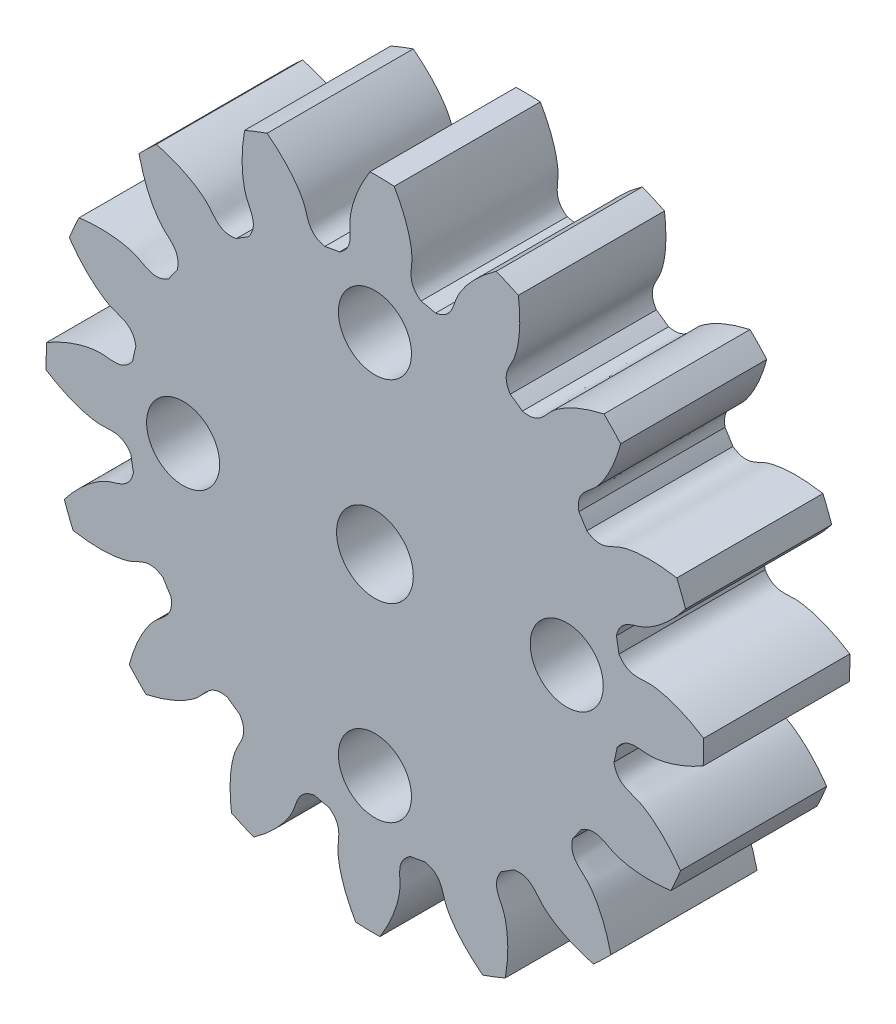
from build123d import *

# Parameters (mm, degrees)
SKETCH_1_R      = 1
SKETCH_1_R_2    = 1.05
EXTRUDE_1_DEPTH = 4


with BuildPart() as part:
    # 草图1 → 凸台-拉伸1 (new body)
    with BuildSketch(Plane.XY):
        with BuildLine():
            ThreePointArc((20.769828885, 7.697327282), (20.52624908, 7.472597504), (20.291108393, 7.239052109))
            add(Edge.make_bspline(
                [(20.291108393, 7.239052109), (20.310990881, 7.149406449), (20.347528876, 7.003899113), (20.407035462, 6.808638334), (20.460548412, 6.655296266), (20.515727337, 6.51540458), (20.571589231, 6.38883337), (20.627164799, 6.275395855), (20.681501491, 6.174849385), (20.733666394, 6.08689649), (20.782749083, 6.011186103), (20.827864425, 5.947314927), (20.868155465, 5.894829115), (20.898627835, 5.858235214), (21.12060735, 5.607984443), (21.441186967, 5.472040644), (21.339743183, 5.007788717)],
                knots=[0, 0, 0, 0, 0.059730766, 0.097547518, 0.132756218, 0.165356867, 0.195349463, 0.222734008, 0.247510501, 0.269678942, 0.289239331, 0.306191668, 0.320535953, 0.332272187, 0.337162284, 0.538120392, 0.538120392, 0.538120392, 0.538120392], degree=3))
            ThreePointArc((21.339743183, 5.007788717), (21.220590284, 4.842962791), (21.106457269, 4.674621903))
            add(Edge.make_bspline(
                [(21.106457269, 4.674621903), (20.704898976, 4.420512417), (20.467508905, 4.675263201), (20.156428637, 4.798264908), (20.111619692, 4.814384318), (20.048518341, 4.834293273), (19.973068846, 4.854842866), (19.885137087, 4.87507102), (19.784646979, 4.894008379), (19.671579972, 4.910679271), (19.545975623, 4.924105326), (19.407931705, 4.933308444), (19.257604227, 4.937313918), (19.095207289, 4.935153529), (18.921012783, 4.925868634), (18.771674168, 4.911908719), (18.680526786, 4.900750478), (18.651101303, 4.896879252)],
                knots=[0, 0, 0, 0, 0.200958108, 0.205848205, 0.217584439, 0.231928724, 0.248881062, 0.268441451, 0.290609892, 0.315386384, 0.342770929, 0.372763526, 0.405364174, 0.440572874, 0.478389626, 0.51881443, 0.538120392, 0.538120392, 0.538120392, 0.538120392], degree=3))
            ThreePointArc((18.651101303, 4.896879252), (18.51206327, 4.596042054), (18.384195556, 4.290289799))
            add(Edge.make_bspline(
                [(18.384195556, 4.290289799), (18.436870488, 4.215076707), (18.52631044, 4.094627942), (18.656010422, 3.93700269), (18.76413141, 3.815811611), (18.868644321, 3.707684607), (18.968690686, 3.612125477), (19.063446473, 3.528590728), (19.1521245, 3.456491654), (19.233976702, 3.395196419), (19.308296304, 3.344032274), (19.374419885, 3.302287896), (19.431729404, 3.269216041), (19.473886083, 3.247068956), (19.774735237, 3.100815274), (20.122935623, 3.097900089), (20.206875309, 2.63016638)],
                knots=[0, 0, 0, 0, 0.059730766, 0.097547518, 0.132756218, 0.165356867, 0.195349463, 0.222734008, 0.247510501, 0.269678942, 0.289239331, 0.306191668, 0.320535953, 0.332272187, 0.337162284, 0.538120392, 0.538120392, 0.538120392, 0.538120392], degree=3))
            ThreePointArc((20.206875309, 2.63016638), (20.159868534, 2.43228924), (20.118844647, 2.233085725))
            add(Edge.make_bspline(
                [(20.118844647, 2.233085725), (19.845096649, 1.844649466), (19.528287917, 1.989163254), (19.193816509, 1.983756749), (19.146249811, 1.981501501), (19.080332937, 1.975747135), (19.002762704, 1.965859212), (18.913783372, 1.950897562), (18.813695605, 1.929937501), (18.702855637, 1.902070527), (18.581674421, 1.866407881), (18.45061659, 1.822083333), (18.310199281, 1.768256073), (18.160990819, 1.704113516), (18.003609255, 1.62887404), (17.870980594, 1.558827347), (17.791041467, 1.513637883), (17.76533732, 1.498800692)],
                knots=[0, 0, 0, 0, 0.200958108, 0.205848205, 0.217584439, 0.231928724, 0.248881062, 0.268441451, 0.290609892, 0.315386384, 0.342770929, 0.372763526, 0.405364174, 0.440572874, 0.478389626, 0.51881443, 0.538120392, 0.538120392, 0.538120392, 0.538120392], degree=3))
            ThreePointArc((17.76533732, 1.498800692), (17.752008339, 1.167655811), (17.750880297, 0.836244704))
            add(Edge.make_bspline(
                [(17.750880297, 0.836244704), (17.828328393, 0.786914691), (17.957053881, 0.709861731), (18.137201612, 0.613869021), (18.283470198, 0.543279175), (18.42140595, 0.483378208), (18.550405635, 0.43337917), (18.669915932, 0.392464595), (18.779434867, 0.359789348), (18.878513112, 0.334483416), (18.966755142, 0.31565479), (19.043820247, 0.302392413), (19.109423389, 0.293769407), (19.156846404, 0.289440831), (19.490763641, 0.269450034), (19.813574444, 0.400007273), (20.070118543, 0)],
                knots=[0, 0, 0, 0, 0.059730766, 0.097547518, 0.132756218, 0.165356867, 0.195349463, 0.222734008, 0.247510501, 0.269678942, 0.289239331, 0.306191668, 0.320535953, 0.332272187, 0.337162284, 0.538120392, 0.538120392, 0.538120392, 0.538120392], degree=3))
            ThreePointArc((20.070118543, 0), (20.10241425, -0.200803354), (20.140745004, -0.400542566))
            add(Edge.make_bspline(
                [(20.140745004, -0.400542566), (20.036482953, -0.864169698), (19.688486817, -0.851893821), (19.381544509, -0.984885447), (19.338461656, -1.005172011), (19.279764506, -1.035713647), (19.2118829, -1.07453374), (19.135402292, -1.122407419), (19.05095432, -1.18007392), (18.959215772, -1.248236267), (18.860906431, -1.327558299), (18.756787053, -1.418662503), (18.647657176, -1.522127784), (18.534352826, -1.638487385), (18.417744121, -1.768226914), (18.322016924, -1.883696412), (18.26545606, -1.956037412), (18.247386472, -1.97958174)],
                knots=[0, 0, 0, 0, 0.200958108, 0.205848205, 0.217584439, 0.231928724, 0.248881062, 0.268441451, 0.290609892, 0.315386384, 0.342770929, 0.372763526, 0.405364174, 0.440572874, 0.478389626, 0.51881443, 0.538120392, 0.538120392, 0.538120392, 0.538120392], degree=3))
            ThreePointArc((18.247386472, -1.97958174), (18.361795759, -2.290620499), (18.487579124, -2.59723612))
            add(Edge.make_bspline(
                [(18.487579124, -2.59723612), (18.578009613, -2.613173006), (18.726423348, -2.635099547), (18.92959297, -2.654845695), (19.091741087, -2.664087645), (19.242100213, -2.666643196), (19.380414185, -2.663470241), (19.506484632, -2.655535769), (19.62017121, -2.643812679), (19.721391734, -2.629276708), (19.810122142, -2.612903328), (19.886396308, -2.595664628), (19.95030559, -2.578526011), (19.995775217, -2.564377091), (20.311924664, -2.455061585), (20.560200866, -2.210908078), (20.950292864, -2.482291434)],
                knots=[0, 0, 0, 0, 0.059730766, 0.097547518, 0.132756218, 0.165356867, 0.195349463, 0.222734008, 0.247510501, 0.269678942, 0.289239331, 0.306191668, 0.320535953, 0.332272187, 0.337162284, 0.538120392, 0.538120392, 0.538120392, 0.538120392], degree=3))
            ThreePointArc((20.950292864, -2.482291434), (21.056974323, -2.655450511), (21.16882421, -2.825316936))
            add(Edge.make_bspline(
                [(21.16882421, -2.825316936), (21.249921057, -3.293551914), (20.923716775, -3.415382838), (20.691032751, -3.655712815), (20.658992717, -3.690942251), (20.6164514, -3.74162147), (20.568592779, -3.803463726), (20.516254375, -3.876961099), (20.460302637, -3.962554839), (20.40163187, -4.060635459), (20.34116111, -4.171540816), (20.279831417, -4.295554886), (20.218603007, -4.432906538), (20.158452328, -4.58376849), (20.100369101, -4.748256405), (20.056116967, -4.891569523), (20.031545244, -4.980048797), (20.023861146, -5.008715852)],
                knots=[0, 0, 0, 0, 0.200958108, 0.205848205, 0.217584439, 0.231928724, 0.248881062, 0.268441451, 0.290609892, 0.315386384, 0.342770929, 0.372763526, 0.405364174, 0.440572874, 0.478389626, 0.51881443, 0.538120392, 0.538120392, 0.538120392, 0.538120392], degree=3))
            ThreePointArc((20.023861146, -5.008715852), (20.248590924, -5.252295657), (20.482136319, -5.487436344))
            add(Edge.make_bspline(
                [(20.482136319, -5.487436344), (20.571781979, -5.467553856), (20.717289315, -5.431015861), (20.912550094, -5.371509275), (21.065892162, -5.317996325), (21.205783848, -5.2628174), (21.332355058, -5.206955507), (21.445792573, -5.151379938), (21.546339044, -5.097043246), (21.634291938, -5.044878343), (21.710002325, -4.995795654), (21.773873501, -4.950680312), (21.826359313, -4.910389272), (21.862953214, -4.879916902), (22.113203985, -4.657937387), (22.249147784, -4.33735777), (22.713399711, -4.438801554)],
                knots=[0, 0, 0, 0, 0.059730766, 0.097547518, 0.132756218, 0.165356867, 0.195349463, 0.222734008, 0.247510501, 0.269678942, 0.289239331, 0.306191668, 0.320535953, 0.332272187, 0.337162284, 0.538120392, 0.538120392, 0.538120392, 0.538120392], degree=3))
            ThreePointArc((22.713399711, -4.438801554), (22.878225637, -4.557954453), (23.046566525, -4.672087468))
            add(Edge.make_bspline(
                [(23.046566525, -4.672087468), (23.300676011, -5.073645761), (23.045925227, -5.311035832), (22.92292352, -5.6221161), (22.90680411, -5.666925045), (22.886895155, -5.730026396), (22.866345562, -5.805475891), (22.846117408, -5.89340765), (22.827180049, -5.993897758), (22.810509157, -6.106964765), (22.797083102, -6.232569114), (22.787879984, -6.370613032), (22.78387451, -6.52094051), (22.786034899, -6.683337448), (22.795319794, -6.857531954), (22.809279709, -7.006870569), (22.82043795, -7.098017951), (22.824309176, -7.127443434)],
                knots=[0, 0, 0, 0, 0.200958108, 0.205848205, 0.217584439, 0.231928724, 0.248881062, 0.268441451, 0.290609892, 0.315386384, 0.342770929, 0.372763526, 0.405364174, 0.440572874, 0.478389626, 0.51881443, 0.538120392, 0.538120392, 0.538120392, 0.538120392], degree=3))
            ThreePointArc((22.824309176, -7.127443434), (23.125146374, -7.266481467), (23.430898629, -7.394349181))
            add(Edge.make_bspline(
                [(23.430898629, -7.394349181), (23.506111721, -7.341674249), (23.626560486, -7.252234297), (23.784185738, -7.122534315), (23.905376817, -7.014413327), (24.013503821, -6.909900416), (24.109062951, -6.809854051), (24.1925977, -6.715098264), (24.264696774, -6.626420237), (24.325992009, -6.544568035), (24.377156154, -6.470248433), (24.418900532, -6.404124852), (24.451972387, -6.346815333), (24.474119472, -6.304658654), (24.620373154, -6.0038095), (24.623288339, -5.655609114), (25.091022048, -5.571669428)],
                knots=[0, 0, 0, 0, 0.059730766, 0.097547518, 0.132756218, 0.165356867, 0.195349463, 0.222734008, 0.247510501, 0.269678942, 0.289239331, 0.306191668, 0.320535953, 0.332272187, 0.337162284, 0.538120392, 0.538120392, 0.538120392, 0.538120392], degree=3))
            ThreePointArc((25.091022048, -5.571669428), (25.288899188, -5.618676203), (25.488102703, -5.65970009))
            add(Edge.make_bspline(
                [(25.488102703, -5.65970009), (25.876538962, -5.933448088), (25.732025174, -6.25025682), (25.737431679, -6.584728228), (25.739686927, -6.632294926), (25.745441293, -6.6982118), (25.755329216, -6.775782033), (25.770290866, -6.864761365), (25.791250927, -6.964849133), (25.819117901, -7.0756891), (25.854780547, -7.196870316), (25.899105095, -7.327928147), (25.952932355, -7.468345456), (26.017074912, -7.617553918), (26.092314388, -7.774935482), (26.162361081, -7.907564143), (26.207550545, -7.98750327), (26.222387736, -8.013207417)],
                knots=[0, 0, 0, 0, 0.200958108, 0.205848205, 0.217584439, 0.231928724, 0.248881062, 0.268441451, 0.290609892, 0.315386384, 0.342770929, 0.372763526, 0.405364174, 0.440572874, 0.478389626, 0.51881443, 0.538120392, 0.538120392, 0.538120392, 0.538120392], degree=3))
            ThreePointArc((26.222387736, -8.013207417), (26.553532617, -8.026536398), (26.884943724, -8.02766444))
            add(Edge.make_bspline(
                [(26.884943724, -8.02766444), (26.934273737, -7.950216344), (27.011326697, -7.821490856), (27.107319407, -7.641343125), (27.177909253, -7.495074539), (27.23781022, -7.357138787), (27.287809258, -7.228139102), (27.328723833, -7.108628805), (27.36139908, -6.99910987), (27.386705012, -6.900031625), (27.405533638, -6.811789595), (27.418796015, -6.73472449), (27.427419021, -6.669121348), (27.431747597, -6.621698333), (27.451738394, -6.287781096), (27.321181155, -5.964970293), (27.721188428, -5.708426194)],
                knots=[0, 0, 0, 0, 0.059730766, 0.097547518, 0.132756218, 0.165356867, 0.195349463, 0.222734008, 0.247510501, 0.269678942, 0.289239331, 0.306191668, 0.320535953, 0.332272187, 0.337162284, 0.538120392, 0.538120392, 0.538120392, 0.538120392], degree=3))
            ThreePointArc((27.721188428, -5.708426194), (27.921991782, -5.676130487), (28.121730994, -5.637799733))
            add(Edge.make_bspline(
                [(28.121730994, -5.637799733), (28.585358126, -5.742061784), (28.573082249, -6.09005792), (28.706073875, -6.397000228), (28.726360439, -6.440083081), (28.756902075, -6.498780231), (28.795722168, -6.566661837), (28.843595847, -6.643142445), (28.901262348, -6.727590417), (28.969424695, -6.819328965), (29.048746727, -6.917638306), (29.139850931, -7.021757684), (29.243316212, -7.130887561), (29.359675813, -7.244191911), (29.489415343, -7.360800616), (29.604884841, -7.456527813), (29.677225841, -7.513088677), (29.700770168, -7.531158265)],
                knots=[0, 0, 0, 0, 0.200958108, 0.205848205, 0.217584439, 0.231928724, 0.248881062, 0.268441451, 0.290609892, 0.315386384, 0.342770929, 0.372763526, 0.405364174, 0.440572874, 0.478389626, 0.51881443, 0.538120392, 0.538120392, 0.538120392, 0.538120392], degree=3))
            ThreePointArc((29.700770168, -7.531158265), (30.011808927, -7.416748978), (30.318424548, -7.290965613))
            add(Edge.make_bspline(
                [(30.318424548, -7.290965613), (30.334361434, -7.200535124), (30.356287975, -7.052121389), (30.376034123, -6.848951767), (30.385276073, -6.68680365), (30.387831624, -6.536444524), (30.384658669, -6.398130552), (30.376724197, -6.272060105), (30.365001107, -6.158373527), (30.350465136, -6.057153003), (30.334091756, -5.968422595), (30.316853056, -5.892148429), (30.299714439, -5.828239147), (30.285565519, -5.78276952), (30.176250013, -5.466620073), (29.932096506, -5.218343871), (30.203479862, -4.828251873)],
                knots=[0, 0, 0, 0, 0.059730766, 0.097547518, 0.132756218, 0.165356867, 0.195349463, 0.222734008, 0.247510501, 0.269678942, 0.289239331, 0.306191668, 0.320535953, 0.332272187, 0.337162284, 0.538120392, 0.538120392, 0.538120392, 0.538120392], degree=3))
            ThreePointArc((30.203479862, -4.828251873), (30.376638939, -4.721570414), (30.546505364, -4.609720527))
            add(Edge.make_bspline(
                [(30.546505364, -4.609720527), (31.014740342, -4.52862368), (31.136571266, -4.854827962), (31.376901243, -5.087511986), (31.412130679, -5.11955202), (31.462809898, -5.162093337), (31.524652154, -5.209951958), (31.598149527, -5.262290362), (31.683743267, -5.3182421), (31.781823887, -5.376912867), (31.892729244, -5.437383628), (32.016743314, -5.49871332), (32.154094966, -5.55994173), (32.304956918, -5.620092409), (32.469444833, -5.678175636), (32.612757951, -5.72242777), (32.701237225, -5.746999493), (32.72990428, -5.754683591)],
                knots=[0, 0, 0, 0, 0.200958108, 0.205848205, 0.217584439, 0.231928724, 0.248881062, 0.268441451, 0.290609892, 0.315386384, 0.342770929, 0.372763526, 0.405364174, 0.440572874, 0.478389626, 0.51881443, 0.538120392, 0.538120392, 0.538120392, 0.538120392], degree=3))
            ThreePointArc((32.72990428, -5.754683591), (32.973484085, -5.529953813), (33.208624772, -5.296408418))
            add(Edge.make_bspline(
                [(33.208624772, -5.296408418), (33.188742284, -5.206762758), (33.152204289, -5.061255422), (33.092697703, -4.865994643), (33.039184754, -4.712652575), (32.984005828, -4.572760889), (32.928143935, -4.446189679), (32.872568366, -4.332752164), (32.818231674, -4.232205694), (32.766066771, -4.144252799), (32.716984082, -4.068542412), (32.671868741, -4.004671237), (32.6315777, -3.952185424), (32.60110533, -3.915591523), (32.379125815, -3.665340752), (32.058546198, -3.529396954), (32.159989982, -3.065145026)],
                knots=[0, 0, 0, 0, 0.059730766, 0.097547518, 0.132756218, 0.165356867, 0.195349463, 0.222734008, 0.247510501, 0.269678942, 0.289239331, 0.306191668, 0.320535953, 0.332272187, 0.337162284, 0.538120392, 0.538120392, 0.538120392, 0.538120392], degree=3))
            ThreePointArc((32.159989982, -3.065145026), (32.279142881, -2.9003191), (32.393275896, -2.731978212))
            add(Edge.make_bspline(
                [(32.393275896, -2.731978212), (32.794834189, -2.477868727), (33.03222426, -2.73261951), (33.343304528, -2.855621217), (33.388113473, -2.871740627), (33.451214824, -2.891649582), (33.526664319, -2.912199175), (33.614596078, -2.932427329), (33.715086186, -2.951364688), (33.828153193, -2.96803558), (33.953757542, -2.981461635), (34.09180146, -2.990664753), (34.242128938, -2.994670227), (34.404525876, -2.992509838), (34.578720382, -2.983224943), (34.728058997, -2.969265028), (34.819206379, -2.958106787), (34.848631862, -2.954235561)],
                knots=[0, 0, 0, 0, 0.200958108, 0.205848205, 0.217584439, 0.231928724, 0.248881062, 0.268441451, 0.290609892, 0.315386384, 0.342770929, 0.372763526, 0.405364174, 0.440572874, 0.478389626, 0.51881443, 0.538120392, 0.538120392, 0.538120392, 0.538120392], degree=3))
            ThreePointArc((34.848631862, -2.954235561), (34.987669895, -2.653398363), (35.115537609, -2.347646108))
            add(Edge.make_bspline(
                [(35.115537609, -2.347646108), (35.062862677, -2.272433016), (34.973422725, -2.151984251), (34.843722743, -1.994358999), (34.735601755, -1.87316792), (34.631088844, -1.765040916), (34.531042479, -1.669481786), (34.436286692, -1.585947037), (34.347608665, -1.513847963), (34.265756463, -1.452552728), (34.191436861, -1.401388583), (34.12531328, -1.359644205), (34.068003761, -1.32657235), (34.025847082, -1.304425265), (33.724997928, -1.158171583), (33.376797542, -1.155256398), (33.292857856, -0.687522689)],
                knots=[0, 0, 0, 0, 0.059730766, 0.097547518, 0.132756218, 0.165356867, 0.195349463, 0.222734008, 0.247510501, 0.269678942, 0.289239331, 0.306191668, 0.320535953, 0.332272187, 0.337162284, 0.538120392, 0.538120392, 0.538120392, 0.538120392], degree=3))
            ThreePointArc((33.292857856, -0.687522689), (33.339864631, -0.489645549), (33.380888518, -0.290442034))
            add(Edge.make_bspline(
                [(33.380888518, -0.290442034), (33.654636516, 0.097994225), (33.971445248, -0.046519563), (34.305916656, -0.041113058), (34.353483355, -0.03885781), (34.419400228, -0.033103444), (34.496970461, -0.023215521), (34.585949793, -0.008253871), (34.686037561, 0.01270619), (34.796877528, 0.040573164), (34.918058744, 0.07623581), (35.049116575, 0.120560358), (35.189533884, 0.174387618), (35.338742346, 0.238530175), (35.49612391, 0.313769651), (35.628752571, 0.383816344), (35.708691698, 0.429005808), (35.734395845, 0.443842999)],
                knots=[0, 0, 0, 0, 0.200958108, 0.205848205, 0.217584439, 0.231928724, 0.248881062, 0.268441451, 0.290609892, 0.315386384, 0.342770929, 0.372763526, 0.405364174, 0.440572874, 0.478389626, 0.51881443, 0.538120392, 0.538120392, 0.538120392, 0.538120392], degree=3))
            ThreePointArc((35.734395845, 0.443842999), (35.747724826, 0.77498788), (35.748852868, 1.106398987))
            add(Edge.make_bspline(
                [(35.748852868, 1.106398987), (35.671404772, 1.155729), (35.542679284, 1.23278196), (35.362531553, 1.32877467), (35.216262967, 1.399364516), (35.078327215, 1.459265483), (34.94932753, 1.509264521), (34.829817233, 1.550179096), (34.720298298, 1.582854343), (34.621220053, 1.608160275), (34.532978023, 1.626988901), (34.455912918, 1.640251278), (34.390309776, 1.648874284), (34.342886761, 1.65320286), (34.008969524, 1.673193657), (33.686158721, 1.542636418), (33.429614622, 1.942643691)],
                knots=[0, 0, 0, 0, 0.059730766, 0.097547518, 0.132756218, 0.165356867, 0.195349463, 0.222734008, 0.247510501, 0.269678942, 0.289239331, 0.306191668, 0.320535953, 0.332272187, 0.337162284, 0.538120392, 0.538120392, 0.538120392, 0.538120392], degree=3))
            ThreePointArc((33.429614622, 1.942643691), (33.397318915, 2.143447045), (33.358988161, 2.343186257))
            add(Edge.make_bspline(
                [(33.358988161, 2.343186257), (33.463250212, 2.806813389), (33.811246348, 2.794537512), (34.118188656, 2.927529137), (34.161271509, 2.947815702), (34.219968659, 2.978357338), (34.287850265, 3.017177431), (34.364330873, 3.06505111), (34.448778845, 3.122717611), (34.540517393, 3.190879958), (34.638826735, 3.27020199), (34.742946112, 3.361306194), (34.852075989, 3.464771475), (34.965380339, 3.581131076), (35.081989044, 3.710870605), (35.177716241, 3.826340103), (35.234277105, 3.898681103), (35.252346693, 3.922225431)],
                knots=[0, 0, 0, 0, 0.200958108, 0.205848205, 0.217584439, 0.231928724, 0.248881062, 0.268441451, 0.290609892, 0.315386384, 0.342770929, 0.372763526, 0.405364174, 0.440572874, 0.478389626, 0.51881443, 0.538120392, 0.538120392, 0.538120392, 0.538120392], degree=3))
            ThreePointArc((35.252346693, 3.922225431), (35.137937406, 4.23326419), (35.012154041, 4.539879811))
            add(Edge.make_bspline(
                [(35.012154041, 4.539879811), (34.921723552, 4.555816697), (34.773309817, 4.577743238), (34.570140195, 4.597489386), (34.407992078, 4.606731336), (34.257632952, 4.609286887), (34.11931898, 4.606113932), (33.993248533, 4.59817946), (33.879561955, 4.58645637), (33.778341431, 4.571920399), (33.689611023, 4.555547018), (33.613336857, 4.538308319), (33.549427576, 4.521169702), (33.503957948, 4.507020782), (33.187808501, 4.397705276), (32.939532299, 4.153551769), (32.549440301, 4.424935125)],
                knots=[0, 0, 0, 0, 0.059730766, 0.097547518, 0.132756218, 0.165356867, 0.195349463, 0.222734008, 0.247510501, 0.269678942, 0.289239331, 0.306191668, 0.320535953, 0.332272187, 0.337162284, 0.538120392, 0.538120392, 0.538120392, 0.538120392], degree=3))
            ThreePointArc((32.549440301, 4.424935125), (32.442758842, 4.598094202), (32.330908955, 4.767960627))
            add(Edge.make_bspline(
                [(32.330908955, 4.767960627), (32.249812108, 5.236195605), (32.57601639, 5.358026529), (32.808700414, 5.598356506), (32.840740448, 5.633585942), (32.883281765, 5.684265161), (32.931140386, 5.746107417), (32.98347879, 5.81960479), (33.039430528, 5.90519853), (33.098101295, 6.00327915), (33.158572056, 6.114184507), (33.219901748, 6.238198577), (33.281130158, 6.375550229), (33.341280837, 6.526412181), (33.399364064, 6.690900096), (33.443616198, 6.834213214), (33.468187921, 6.922692488), (33.475872019, 6.951359543)],
                knots=[0, 0, 0, 0, 0.200958108, 0.205848205, 0.217584439, 0.231928724, 0.248881062, 0.268441451, 0.290609892, 0.315386384, 0.342770929, 0.372763526, 0.405364174, 0.440572874, 0.478389626, 0.51881443, 0.538120392, 0.538120392, 0.538120392, 0.538120392], degree=3))
            ThreePointArc((33.475872019, 6.951359543), (33.251142241, 7.194939348), (33.017596846, 7.430080035))
            add(Edge.make_bspline(
                [(33.017596846, 7.430080035), (32.927951186, 7.410197547), (32.78244385, 7.373659552), (32.587183071, 7.314152966), (32.433841003, 7.260640016), (32.293949317, 7.205461091), (32.167378107, 7.149599197), (32.053940592, 7.094023629), (31.953394122, 7.039686937), (31.865441227, 6.987522034), (31.78973084, 6.938439345), (31.725859665, 6.893324003), (31.673373852, 6.853032963), (31.636779951, 6.822560593), (31.38652918, 6.600581078), (31.250585382, 6.280001461), (30.786333454, 6.381445245)],
                knots=[0, 0, 0, 0, 0.059730766, 0.097547518, 0.132756218, 0.165356867, 0.195349463, 0.222734008, 0.247510501, 0.269678942, 0.289239331, 0.306191668, 0.320535953, 0.332272187, 0.337162284, 0.538120392, 0.538120392, 0.538120392, 0.538120392], degree=3))
            ThreePointArc((30.786333454, 6.381445245), (30.621507528, 6.500598144), (30.45316664, 6.614731159))
            add(Edge.make_bspline(
                [(30.45316664, 6.614731159), (30.199057155, 7.016289452), (30.453807938, 7.253679523), (30.576809645, 7.564759791), (30.592929055, 7.609568736), (30.61283801, 7.672670087), (30.633387603, 7.748119582), (30.653615757, 7.836051341), (30.672553116, 7.936541449), (30.689224008, 8.049608456), (30.702650063, 8.175212805), (30.711853181, 8.313256723), (30.715858655, 8.463584201), (30.713698266, 8.625981139), (30.704413371, 8.800175645), (30.690453456, 8.94951426), (30.679295215, 9.040661642), (30.675423989, 9.070087125)],
                knots=[0, 0, 0, 0, 0.200958108, 0.205848205, 0.217584439, 0.231928724, 0.248881062, 0.268441451, 0.290609892, 0.315386384, 0.342770929, 0.372763526, 0.405364174, 0.440572874, 0.478389626, 0.51881443, 0.538120392, 0.538120392, 0.538120392, 0.538120392], degree=3))
            ThreePointArc((30.675423989, 9.070087125), (30.374586791, 9.209125158), (30.068834536, 9.336992872))
            add(Edge.make_bspline(
                [(30.068834536, 9.336992872), (29.993621444, 9.28431794), (29.873172679, 9.194877988), (29.715547427, 9.065178006), (29.594356348, 8.957057018), (29.486229344, 8.852544107), (29.390670214, 8.752497742), (29.307135465, 8.657741955), (29.235036391, 8.569063928), (29.173741156, 8.487211726), (29.122577011, 8.412892124), (29.080832633, 8.346768543), (29.047760778, 8.289459024), (29.025613693, 8.247302345), (28.879360011, 7.946453191), (28.876444826, 7.598252805), (28.408711117, 7.514313119)],
                knots=[0, 0, 0, 0, 0.059730766, 0.097547518, 0.132756218, 0.165356867, 0.195349463, 0.222734008, 0.247510501, 0.269678942, 0.289239331, 0.306191668, 0.320535953, 0.332272187, 0.337162284, 0.538120392, 0.538120392, 0.538120392, 0.538120392], degree=3))
            ThreePointArc((28.408711117, 7.514313119), (28.210833977, 7.561319894), (28.011630462, 7.602343781))
            add(Edge.make_bspline(
                [(28.011630462, 7.602343781), (27.623194204, 7.876091779), (27.767707991, 8.192900511), (27.762301486, 8.527371919), (27.760046238, 8.574938617), (27.754291872, 8.640855491), (27.744403949, 8.718425724), (27.729442299, 8.807405056), (27.708482238, 8.907492823), (27.680615264, 9.018332791), (27.644952618, 9.139514007), (27.60062807, 9.270571838), (27.54680081, 9.410989147), (27.482658253, 9.560197609), (27.407418777, 9.717579173), (27.337372084, 9.850207834), (27.29218262, 9.930146961), (27.277345429, 9.955851108)],
                knots=[0, 0, 0, 0, 0.200958108, 0.205848205, 0.217584439, 0.231928724, 0.248881062, 0.268441451, 0.290609892, 0.315386384, 0.342770929, 0.372763526, 0.405364174, 0.440572874, 0.478389626, 0.51881443, 0.538120392, 0.538120392, 0.538120392, 0.538120392], degree=3))
            ThreePointArc((27.277345429, 9.955851108), (26.946200548, 9.969180089), (26.614789441, 9.970308131))
            add(Edge.make_bspline(
                [(26.614789441, 9.970308131), (26.565459428, 9.892860035), (26.488406468, 9.764134547), (26.392413758, 9.583986816), (26.321823912, 9.43771823), (26.261922945, 9.299782478), (26.211923907, 9.170782793), (26.171009332, 9.051272496), (26.138334085, 8.941753561), (26.113028153, 8.842675316), (26.094199527, 8.754433286), (26.08093715, 8.677368181), (26.072314144, 8.611765039), (26.067985568, 8.564342024), (26.047994771, 8.230424787), (26.17855201, 7.907613984), (25.778544737, 7.651069885)],
                knots=[0, 0, 0, 0, 0.059730766, 0.097547518, 0.132756218, 0.165356867, 0.195349463, 0.222734008, 0.247510501, 0.269678942, 0.289239331, 0.306191668, 0.320535953, 0.332272187, 0.337162284, 0.538120392, 0.538120392, 0.538120392, 0.538120392], degree=3))
            ThreePointArc((25.778544737, 7.651069885), (25.577741383, 7.618774178), (25.378002171, 7.580443424))
            add(Edge.make_bspline(
                [(25.378002171, 7.580443424), (24.914375039, 7.684705475), (24.926650916, 8.032701611), (24.793659291, 8.339643919), (24.773372726, 8.382726772), (24.74283109, 8.441423922), (24.704010997, 8.509305528), (24.656137318, 8.585786136), (24.598470817, 8.670234108), (24.53030847, 8.761972656), (24.450986438, 8.860281997), (24.359882234, 8.964401375), (24.256416953, 9.073531252), (24.140057352, 9.186835602), (24.010317823, 9.303444307), (23.894848325, 9.399171504), (23.822507325, 9.455732368), (23.798962997, 9.473801956)],
                knots=[0, 0, 0, 0, 0.200958108, 0.205848205, 0.217584439, 0.231928724, 0.248881062, 0.268441451, 0.290609892, 0.315386384, 0.342770929, 0.372763526, 0.405364174, 0.440572874, 0.478389626, 0.51881443, 0.538120392, 0.538120392, 0.538120392, 0.538120392], degree=3))
            ThreePointArc((23.798962997, 9.473801956), (23.487924238, 9.359392669), (23.181308617, 9.233609304))
            add(Edge.make_bspline(
                [(23.181308617, 9.233609304), (23.165371731, 9.143178815), (23.14344519, 8.99476508), (23.123699042, 8.791595458), (23.114457092, 8.629447341), (23.111901541, 8.479088215), (23.115074496, 8.340774243), (23.123008968, 8.214703796), (23.134732058, 8.101017218), (23.149268029, 7.999796694), (23.16564141, 7.911066286), (23.182880109, 7.83479212), (23.200018726, 7.770882838), (23.214167646, 7.725413211), (23.323483152, 7.409263764), (23.567636659, 7.160987562), (23.296253303, 6.770895564)],
                knots=[0, 0, 0, 0, 0.059730766, 0.097547518, 0.132756218, 0.165356867, 0.195349463, 0.222734008, 0.247510501, 0.269678942, 0.289239331, 0.306191668, 0.320535953, 0.332272187, 0.337162284, 0.538120392, 0.538120392, 0.538120392, 0.538120392], degree=3))
            ThreePointArc((23.296253303, 6.770895564), (23.123094226, 6.664214105), (22.953227801, 6.552364218))
            add(Edge.make_bspline(
                [(22.953227801, 6.552364218), (22.484992823, 6.471267371), (22.363161899, 6.797471653), (22.122831922, 7.030155677), (22.087602486, 7.062195711), (22.036923267, 7.104737028), (21.975081011, 7.152595649), (21.901583638, 7.204934053), (21.815989898, 7.260885791), (21.717909278, 7.319556558), (21.607003921, 7.380027318), (21.482989851, 7.441357011), (21.345638199, 7.502585421), (21.194776247, 7.5627361), (21.030288332, 7.620819327), (20.886975214, 7.665071461), (20.79849594, 7.689643184), (20.769828885, 7.697327282)],
                knots=[0, 0, 0, 0, 0.200958108, 0.205848205, 0.217584439, 0.231928724, 0.248881062, 0.268441451, 0.290609892, 0.315386384, 0.342770929, 0.372763526, 0.405364174, 0.440572874, 0.478389626, 0.51881443, 0.538120392, 0.538120392, 0.538120392, 0.538120392], degree=3))
        make_face()
        with Locations((26.749866583, -4.278678155)):
            Circle(SKETCH_1_R, mode=Mode.SUBTRACT)
        with Locations((31.999866583, 0.971321845)):
            Circle(SKETCH_1_R, mode=Mode.SUBTRACT)
        with Locations((26.749866583, 6.221321845)):
            Circle(SKETCH_1_R, mode=Mode.SUBTRACT)
        with Locations((21.499866583, 0.971321845)):
            Circle(SKETCH_1_R, mode=Mode.SUBTRACT)
        with Locations((26.749866583, 0.971321845)):
            Circle(SKETCH_1_R_2, mode=Mode.SUBTRACT)
    extrude(amount=EXTRUDE_1_DEPTH)


solid = part.part
